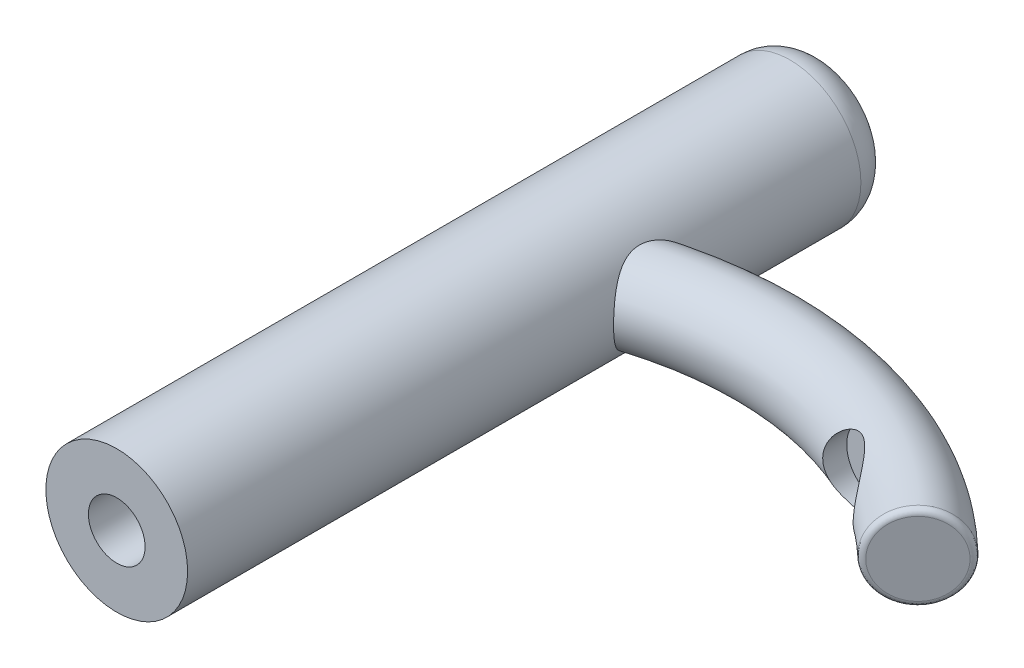
from build123d import *

# Parameters (mm, degrees)
SWEEP1_PROFILE_R   = 30
SKETCH32_R         = 25
CUT_EXTRUDE1_DEPTH = 310
FILLET1_R          = 4


with BuildPart() as part:
    # Sketch1 → Revolve1 (revolve)
    with BuildSketch(Plane(origin=(0, 0, 0), x_dir=(1, 0, 0), z_dir=(0, 1, 0))):
        with BuildLine():
            Line((0, 474.99999), (20, 474.99999))
            Line((20, 474.99999), (20, 0))
            Line((20, 0), (50, 0))
            Line((50, 0), (50, 475))
            ThreePointArc((50, 475), (42.67766953, 492.67766953), (25, 500))
            Line((25, 500), (0, 500))
            Line((0, 500), (0, 474.99999))
        make_face()
    revolve(axis=Axis((0, 0, 0), (0, 0, -1)))

    # Sweep1: sweep along a curve in space
    with BuildLine() as sweep1_path:
        ThreePointArc((0, 0, -312.675247361), (157.645703228, 0, -337.320292822), (300, 0, -265.245330439))
    # Sweep1 profile (on start of the path) → Sweep1 (sweep)
    with BuildSketch(Plane(origin=(0, 0, -312.675247361), x_dir=(0.45016951101566693, 0, 0.892943117646312), z_dir=(0.892943117646312, 0, -0.45016951101566693))):
        Circle(SWEEP1_PROFILE_R)
    sweep(path=sweep1_path.line)

    # Sketch32 → Cut-Extrude1 (cut)
    with BuildSketch(Plane.XY):
        with Locations((230, 0)):
            Circle(SKETCH32_R)
    extrude(amount=-CUT_EXTRUDE1_DEPTH, mode=Mode.SUBTRACT)

    # Fillet1
    fillet1_edges = [part.edges().sort_by_distance(p)[0] for p in [
        (321.110299285, 0, -286.560941247),
    ]]
    fillet(fillet1_edges, radius=FILLET1_R)


solid = part.part
